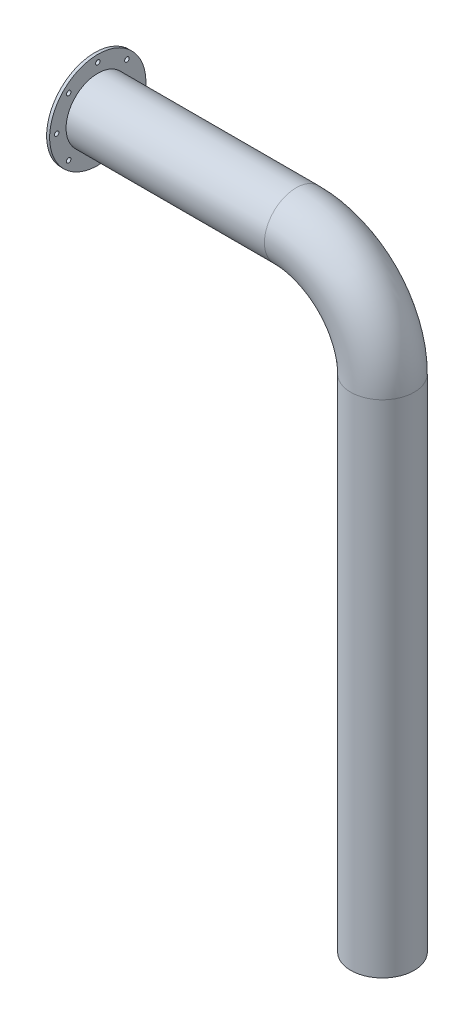
from build123d import *

# Parameters (mm, degrees)
SKETCH1_R           = 127.5
SKETCH1_R_2         = 80
SKETCH1_R_3         = 6
BOSS_EXTRUDE1_DEPTH = 8
SKETCH2_R           = 84
SKETCH2_R_2         = 80
BOSS_EXTRUDE2_DEPTH = 525.2
SKETCH3_R           = 84
SKETCH3_R_2         = 80
SKETCH5_R           = 84
SKETCH5_R_2         = 80
BOSS_EXTRUDE3_DEPTH = 1325.9


with BuildPart() as part:
    # Sketch1 → Boss-Extrude1 (new body)
    with BuildSketch(Plane(origin=(0, 0, 0), x_dir=(0, 0, -1), z_dir=(1, 0, 0))):
        Circle(SKETCH1_R)
        Circle(SKETCH1_R_2, mode=Mode.SUBTRACT)
        with Locations((0, 109)):
            Circle(SKETCH1_R_3, mode=Mode.SUBTRACT)
        with Locations((77.074639149, 77.074639149)):
            Circle(SKETCH1_R_3, mode=Mode.SUBTRACT)
        with Locations((109, 0)):
            Circle(SKETCH1_R_3, mode=Mode.SUBTRACT)
        with Locations((77.074639149, -77.074639149)):
            Circle(SKETCH1_R_3, mode=Mode.SUBTRACT)
        with Locations((0, -109)):
            Circle(SKETCH1_R_3, mode=Mode.SUBTRACT)
        with Locations((-77.074639149, -77.074639149)):
            Circle(SKETCH1_R_3, mode=Mode.SUBTRACT)
        with Locations((-109, 0)):
            Circle(SKETCH1_R_3, mode=Mode.SUBTRACT)
        with Locations((-77.074639149, 77.074639149)):
            Circle(SKETCH1_R_3, mode=Mode.SUBTRACT)
    extrude(amount=BOSS_EXTRUDE1_DEPTH)

    # Sketch2 → Boss-Extrude2 (add)
    with BuildSketch(Plane(origin=(8, 0, 0), x_dir=(0, 0, -1), z_dir=(1, 0, 0))):
        Circle(SKETCH2_R)
        Circle(SKETCH2_R_2, mode=Mode.SUBTRACT)
    extrude(amount=BOSS_EXTRUDE2_DEPTH)

    # Sweep1: sweep along a path in Sketch4
    with BuildLine(Plane.XY) as sweep1_path:
        ThreePointArc((533.2, 0), (694.844610179, -66.955389821), (761.8, -228.6))
    # Sketch3 → Sweep1 (sweep)
    with BuildSketch(Plane(origin=(533.2, 0, 0), x_dir=(0, 0, -1), z_dir=(1, 0, 0))):
        Circle(SKETCH3_R)
        Circle(SKETCH3_R_2, mode=Mode.SUBTRACT)
    sweep(path=sweep1_path.line)

    # Sketch5 → Boss-Extrude3 (add)
    with BuildSketch(Plane.XZ.offset(228.6)):
        with Locations((761.8, 0)):
            Circle(SKETCH5_R)
        with Locations((761.8, 0)):
            Circle(SKETCH5_R_2, mode=Mode.SUBTRACT)
    extrude(amount=BOSS_EXTRUDE3_DEPTH)


solid = part.part
